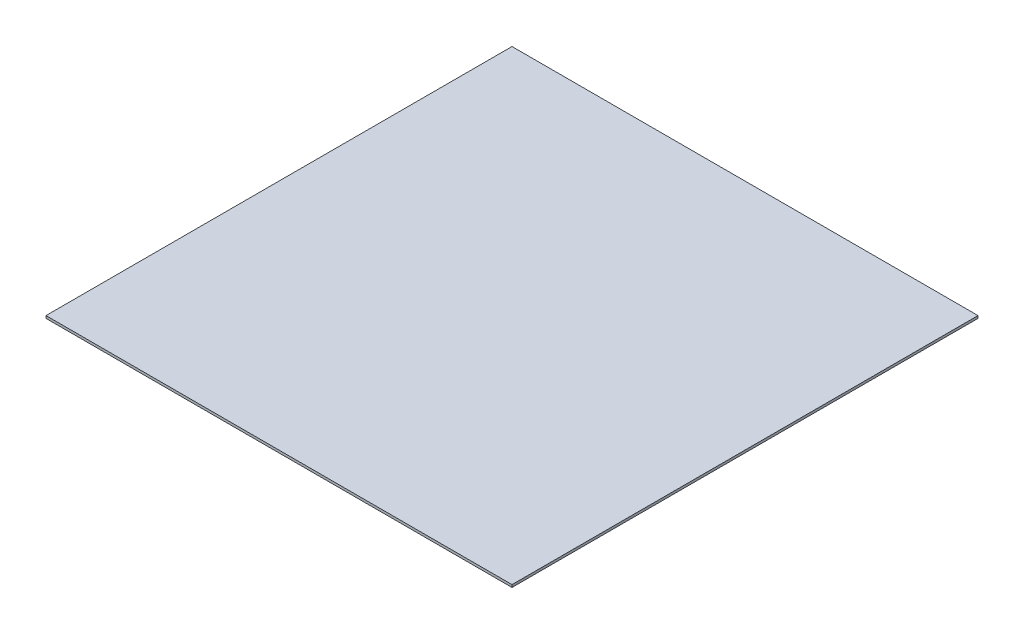
from build123d import *

# Parameters (mm, degrees)
SKETCH1_W           = 1500
SKETCH1_H           = 1500
BOSS_EXTRUDE1_DEPTH = 8


with BuildPart() as part:
    # Sketch1 → Boss-Extrude1 (new body)
    with BuildSketch(Plane(origin=(0, 0, 0), x_dir=(1, 0, 0), z_dir=(0, 1, 0))):
        Rectangle(SKETCH1_W, SKETCH1_H)
    extrude(amount=BOSS_EXTRUDE1_DEPTH)


solid = part.part
